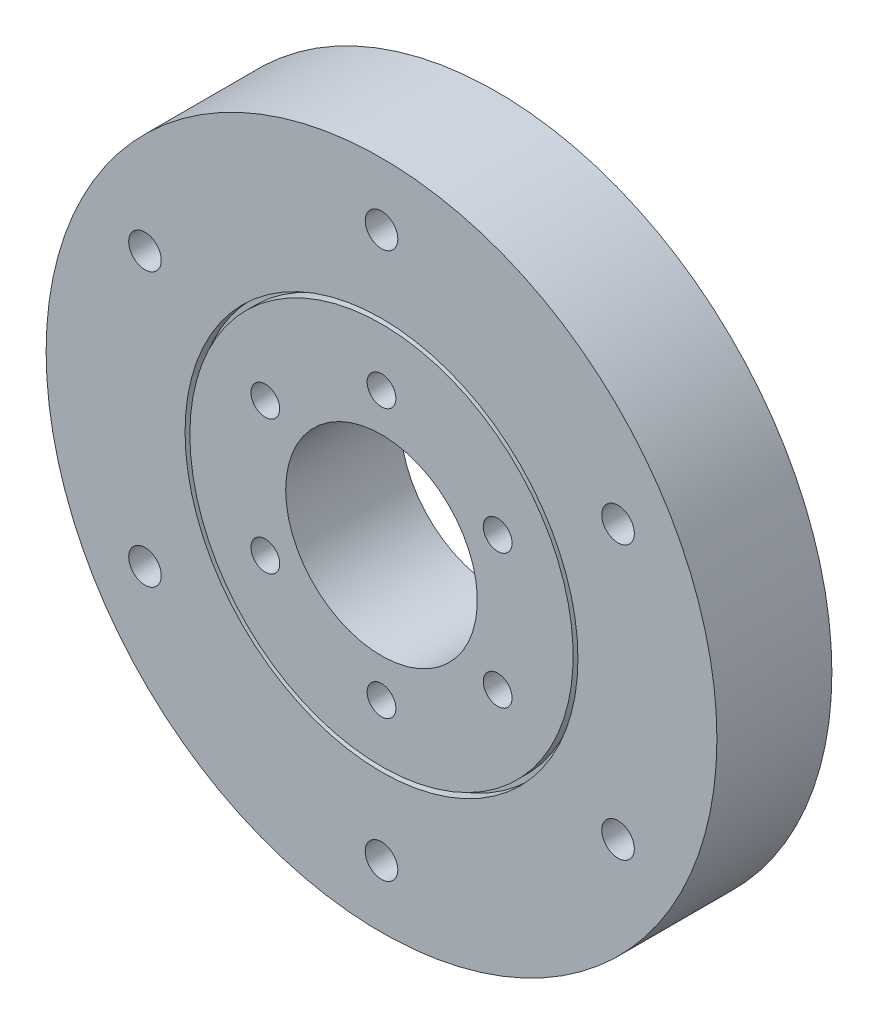
from build123d import *

# Parameters (mm, degrees)
CUT_EXTRUDE_1_REACH = 52.931
SKETCH_2_R          = 1.7
SKETCH_2_R_2        = 1.5


with BuildPart() as part:
    # 草图1 → 旋转1 (revolve)
    with BuildSketch(Plane(origin=(0, 0, 0), x_dir=(1, 0, 0), z_dir=(0, 1, 0))):
        Polygon((10, 6), (20, 6), (20, 5), (20.5, 5), (20.5, 6), (35, 6), (35, -6), (20.5, -6), (20.5, -5), (20, -5), (20, -6), (10, -6), align=None)
    revolve(axis=Axis((0, 0, -11.223459705), (0, 0, 1)))

    # 草图2 → 切除-拉伸1 (cut, up to next)
    with BuildSketch(Plane(origin=(0, 0, -6), x_dir=(-1, 0, 0), z_dir=(0, 0, -1)), mode=Mode.PRIVATE) as cut_extrude_1_sk1:
        with Locations((0, 28.5)):
            Circle(SKETCH_2_R)
    cut_extrude_1_tool1 = extrude(cut_extrude_1_sk1.sketch, amount=-CUT_EXTRUDE_1_REACH, mode=Mode.PRIVATE) & part.part
    # 草图2 → 切除-拉伸1 (cut, up to next)
    with BuildSketch(Plane(origin=(0, 0, -6), x_dir=(-1, 0, 0), z_dir=(0, 0, -1)), mode=Mode.PRIVATE) as cut_extrude_1_sk2:
        with Locations((24.681724008, 14.25)):
            Circle(SKETCH_2_R)
    cut_extrude_1_tool2 = extrude(cut_extrude_1_sk2.sketch, amount=-CUT_EXTRUDE_1_REACH, mode=Mode.PRIVATE) & part.part
    # 草图2 → 切除-拉伸1 (cut, up to next)
    with BuildSketch(Plane(origin=(0, 0, -6), x_dir=(-1, 0, 0), z_dir=(0, 0, -1)), mode=Mode.PRIVATE) as cut_extrude_1_sk3:
        with Locations((24.681724008, -14.25)):
            Circle(SKETCH_2_R)
    cut_extrude_1_tool3 = extrude(cut_extrude_1_sk3.sketch, amount=-CUT_EXTRUDE_1_REACH, mode=Mode.PRIVATE) & part.part
    # 草图2 → 切除-拉伸1 (cut, up to next)
    with BuildSketch(Plane(origin=(0, 0, -6), x_dir=(-1, 0, 0), z_dir=(0, 0, -1)), mode=Mode.PRIVATE) as cut_extrude_1_sk4:
        with Locations((0, -28.5)):
            Circle(SKETCH_2_R)
    cut_extrude_1_tool4 = extrude(cut_extrude_1_sk4.sketch, amount=-CUT_EXTRUDE_1_REACH, mode=Mode.PRIVATE) & part.part
    # 草图2 → 切除-拉伸1 (cut, up to next)
    with BuildSketch(Plane(origin=(0, 0, -6), x_dir=(-1, 0, 0), z_dir=(0, 0, -1)), mode=Mode.PRIVATE) as cut_extrude_1_sk5:
        with Locations((-24.681724008, -14.25)):
            Circle(SKETCH_2_R)
    cut_extrude_1_tool5 = extrude(cut_extrude_1_sk5.sketch, amount=-CUT_EXTRUDE_1_REACH, mode=Mode.PRIVATE) & part.part
    # 草图2 → 切除-拉伸1 (cut, up to next)
    with BuildSketch(Plane(origin=(0, 0, -6), x_dir=(-1, 0, 0), z_dir=(0, 0, -1)), mode=Mode.PRIVATE) as cut_extrude_1_sk6:
        with Locations((-24.681724008, 14.25)):
            Circle(SKETCH_2_R)
    cut_extrude_1_tool6 = extrude(cut_extrude_1_sk6.sketch, amount=-CUT_EXTRUDE_1_REACH, mode=Mode.PRIVATE) & part.part
    # 草图2 → 切除-拉伸1 (cut, up to next)
    with BuildSketch(Plane(origin=(0, 0, -6), x_dir=(-1, 0, 0), z_dir=(0, 0, -1)), mode=Mode.PRIVATE) as cut_extrude_1_sk7:
        with Locations((0, 14)):
            Circle(SKETCH_2_R_2)
    cut_extrude_1_tool7 = extrude(cut_extrude_1_sk7.sketch, amount=-CUT_EXTRUDE_1_REACH, mode=Mode.PRIVATE) & part.part
    # 草图2 → 切除-拉伸1 (cut, up to next)
    with BuildSketch(Plane(origin=(0, 0, -6), x_dir=(-1, 0, 0), z_dir=(0, 0, -1)), mode=Mode.PRIVATE) as cut_extrude_1_sk8:
        with Locations((12.124355653, 7)):
            Circle(SKETCH_2_R_2)
    cut_extrude_1_tool8 = extrude(cut_extrude_1_sk8.sketch, amount=-CUT_EXTRUDE_1_REACH, mode=Mode.PRIVATE) & part.part
    # 草图2 → 切除-拉伸1 (cut, up to next)
    with BuildSketch(Plane(origin=(0, 0, -6), x_dir=(-1, 0, 0), z_dir=(0, 0, -1)), mode=Mode.PRIVATE) as cut_extrude_1_sk9:
        with Locations((12.124355653, -7)):
            Circle(SKETCH_2_R_2)
    cut_extrude_1_tool9 = extrude(cut_extrude_1_sk9.sketch, amount=-CUT_EXTRUDE_1_REACH, mode=Mode.PRIVATE) & part.part
    # 草图2 → 切除-拉伸1 (cut, up to next)
    with BuildSketch(Plane(origin=(0, 0, -6), x_dir=(-1, 0, 0), z_dir=(0, 0, -1)), mode=Mode.PRIVATE) as cut_extrude_1_sk10:
        with Locations((0, -14)):
            Circle(SKETCH_2_R_2)
    cut_extrude_1_tool10 = extrude(cut_extrude_1_sk10.sketch, amount=-CUT_EXTRUDE_1_REACH, mode=Mode.PRIVATE) & part.part
    # 草图2 → 切除-拉伸1 (cut, up to next)
    with BuildSketch(Plane(origin=(0, 0, -6), x_dir=(-1, 0, 0), z_dir=(0, 0, -1)), mode=Mode.PRIVATE) as cut_extrude_1_sk11:
        with Locations((-12.124355653, -7)):
            Circle(SKETCH_2_R_2)
    cut_extrude_1_tool11 = extrude(cut_extrude_1_sk11.sketch, amount=-CUT_EXTRUDE_1_REACH, mode=Mode.PRIVATE) & part.part
    # 草图2 → 切除-拉伸1 (cut, up to next)
    with BuildSketch(Plane(origin=(0, 0, -6), x_dir=(-1, 0, 0), z_dir=(0, 0, -1)), mode=Mode.PRIVATE) as cut_extrude_1_sk12:
        with Locations((-12.124355653, 7)):
            Circle(SKETCH_2_R_2)
    cut_extrude_1_tool12 = extrude(cut_extrude_1_sk12.sketch, amount=-CUT_EXTRUDE_1_REACH, mode=Mode.PRIVATE) & part.part
    add(cut_extrude_1_tool1.solids().sort_by_distance((0, 28.5, -6))[0], mode=Mode.SUBTRACT)
    add(cut_extrude_1_tool2.solids().sort_by_distance((-24.681724, 14.25, -6))[0], mode=Mode.SUBTRACT)
    add(cut_extrude_1_tool3.solids().sort_by_distance((-24.681724, -14.25, -6))[0], mode=Mode.SUBTRACT)
    add(cut_extrude_1_tool4.solids().sort_by_distance((0, -28.5, -6))[0], mode=Mode.SUBTRACT)
    add(cut_extrude_1_tool5.solids().sort_by_distance((24.681724, -14.25, -6))[0], mode=Mode.SUBTRACT)
    add(cut_extrude_1_tool6.solids().sort_by_distance((24.681724, 14.25, -6))[0], mode=Mode.SUBTRACT)
    add(cut_extrude_1_tool7.solids().sort_by_distance((0, 14, -6))[0], mode=Mode.SUBTRACT)
    add(cut_extrude_1_tool8.solids().sort_by_distance((-12.124356, 7, -6))[0], mode=Mode.SUBTRACT)
    add(cut_extrude_1_tool9.solids().sort_by_distance((-12.124356, -7, -6))[0], mode=Mode.SUBTRACT)
    add(cut_extrude_1_tool10.solids().sort_by_distance((0, -14, -6))[0], mode=Mode.SUBTRACT)
    add(cut_extrude_1_tool11.solids().sort_by_distance((12.124356, -7, -6))[0], mode=Mode.SUBTRACT)
    add(cut_extrude_1_tool12.solids().sort_by_distance((12.124356, 7, -6))[0], mode=Mode.SUBTRACT)


solid = part.part
